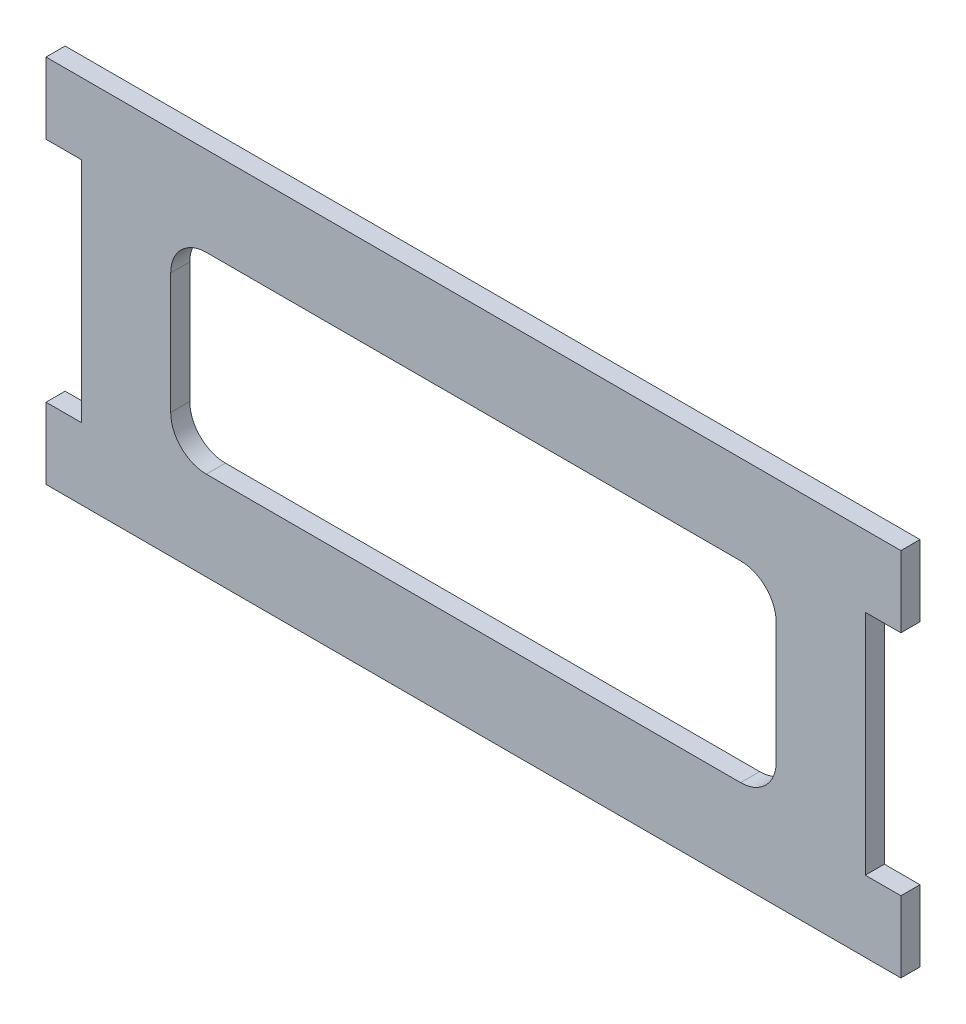
from build123d import *

# Parameters (mm, degrees)
BOSS_EXTRUDE1_DEPTH = 3.4036


with BuildPart() as part:
    # Sketch1 → Boss-Extrude1 (new body)
    with BuildSketch(Plane.XY):
        Polygon((8548.865297466, 2983.807539807), (8548.865297466, 2943.218339807), (8542.515297466, 2943.218339807), (8542.515297466, 2930.518339807), (8694.915297466, 2930.518339807), (8694.915297466, 2943.218339807), (8688.565297466, 2943.218339807), (8688.565297466, 2983.807539807), (8694.915297466, 2983.807539807), (8694.915297466, 2996.507539807), (8542.515297466, 2996.507539807), (8542.515297466, 2983.807539807), align=None)
        with BuildLine():
            ThreePointArc((8571.090297466, 2946.393339807), (8566.600169406, 2948.253211746), (8564.740297466, 2952.743339807))
            Line((8564.740297466, 2952.743339807), (8564.740297466, 2974.282539807))
            ThreePointArc((8564.740297466, 2974.282539807), (8566.600169406, 2978.772667867), (8571.090297466, 2980.632539807))
            Line((8571.090297466, 2980.632539807), (8666.340297466, 2980.632539807))
            ThreePointArc((8666.340297466, 2980.632539807), (8670.830425527, 2978.772667867), (8672.690297466, 2974.282539807))
            Line((8672.690297466, 2974.282539807), (8672.690297466, 2952.743339807))
            ThreePointArc((8672.690297466, 2952.743339807), (8670.830425527, 2948.253211746), (8666.340297466, 2946.393339807))
            Line((8666.340297466, 2946.393339807), (8571.090297466, 2946.393339807))
        make_face(mode=Mode.SUBTRACT)
    extrude(amount=BOSS_EXTRUDE1_DEPTH)


solid = part.part
